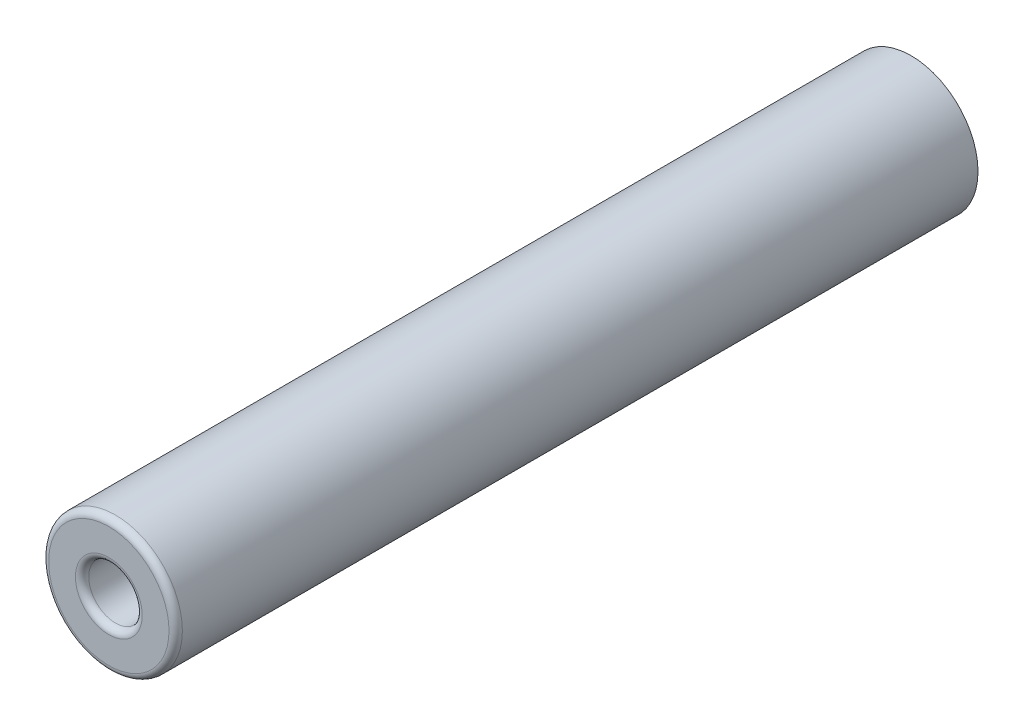
from build123d import *

# Parameters (mm, degrees)
CROQUIS1_R              = 2.5
SALIENTE_EXTRUIR1_DEPTH = 30
CROQUIS2_R              = 1
CORTAR_EXTRUIR1_DEPTH   = 10
REDONDEO1_R             = 0.25


with BuildPart() as part:
    # Croquis1 → Saliente-Extruir1 (new body)
    with BuildSketch(Plane.XY):
        Circle(CROQUIS1_R)
    extrude(amount=SALIENTE_EXTRUIR1_DEPTH)

    # Croquis2 → Cortar-Extruir1 (cut)
    with BuildSketch(Plane.XY.offset(30)):
        Circle(CROQUIS2_R)
    extrude(amount=-CORTAR_EXTRUIR1_DEPTH, mode=Mode.SUBTRACT)

    # Redondeo1
    redondeo1_edges = [part.edges().sort_by_distance(p)[0] for p in [
        (-2.5, 0, 30),
        (-1, 0, 30),
    ]]
    fillet(redondeo1_edges, radius=REDONDEO1_R)


solid = part.part
